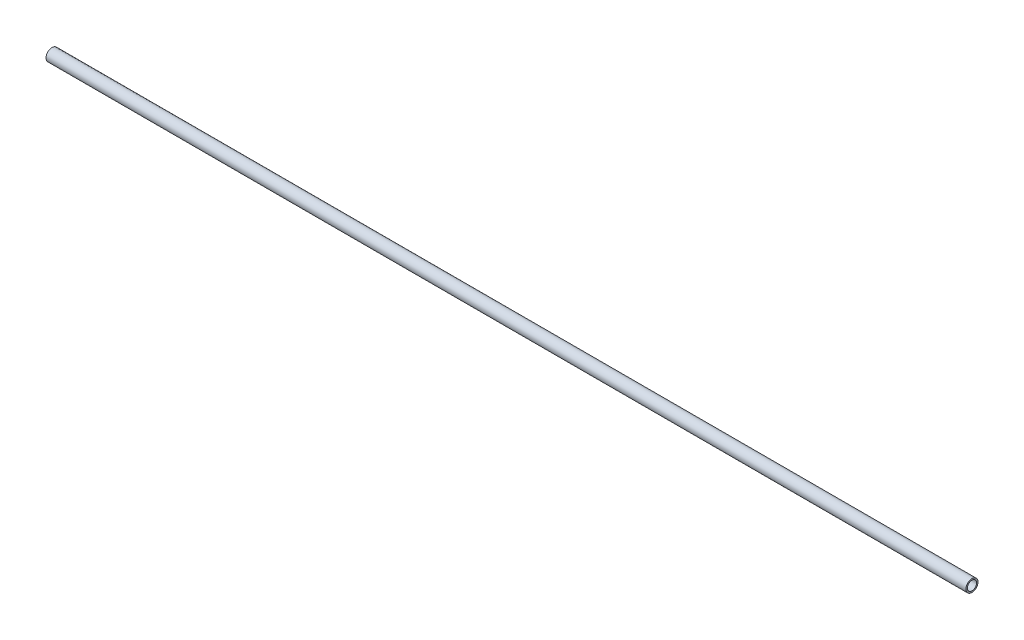
from build123d import *

# Parameters (mm, degrees)
SKETCH1_R           = 12.7
SKETCH1_R_2         = 9.652
BOSS_EXTRUDE1_DEPTH = 1930.4


with BuildPart() as part:
    # Sketch1 → Boss-Extrude1 (new body)
    with BuildSketch(Plane(origin=(0, 0, 0), x_dir=(0, 0, -1), z_dir=(1, 0, 0))):
        with Locations(Location((0, 0, 0), (0, 0, 180))):
            Circle(SKETCH1_R)
        with Locations(Location((0, 0, 0), (0, 0, 180))):
            Circle(SKETCH1_R_2, mode=Mode.SUBTRACT)
    extrude(amount=BOSS_EXTRUDE1_DEPTH)


solid = part.part
